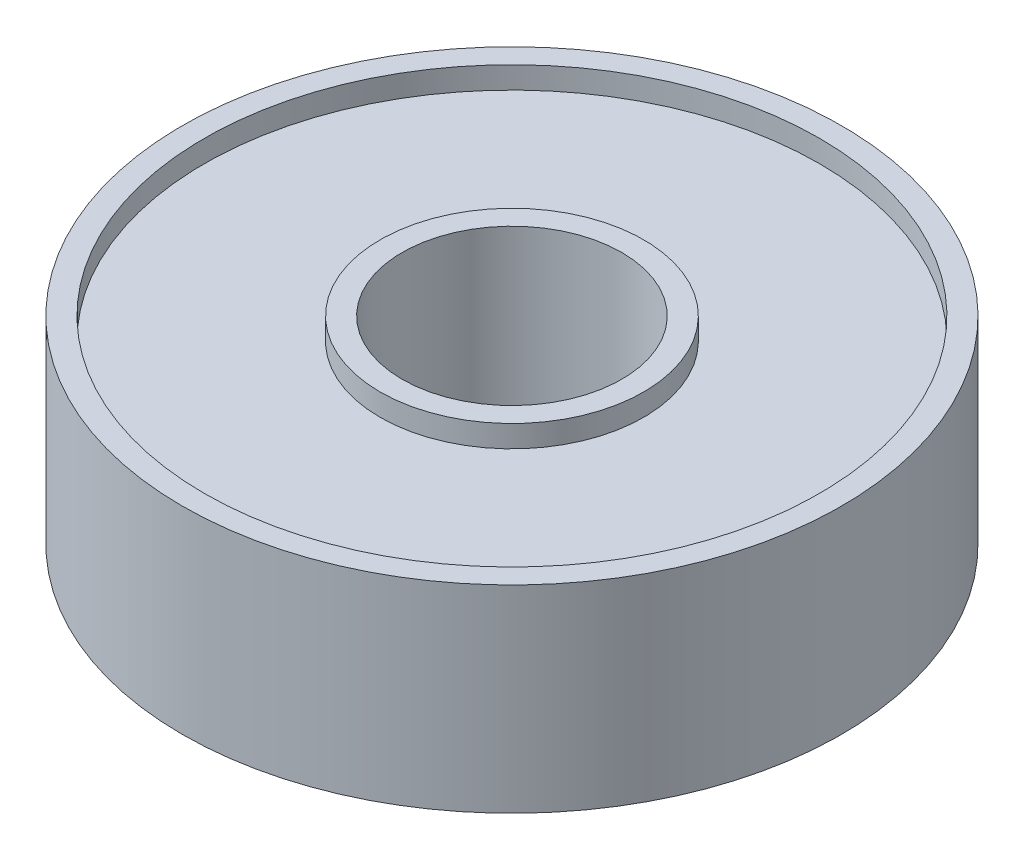
from build123d import *

# Parameters (mm, degrees)
SKETCH1_R            = 15
MAIN_EXTRUSION_DEPTH = 9
SKETCH2_R            = 5
ID_BORE_DEPTH        = 20
SKETCH3_R            = 14
SKETCH3_R_2          = 6
FACE_RECESS_DEPTH    = 1
CUT_EXTRUDE1_START   = -1
SKETCH4_R            = 14
SKETCH4_R_2          = 6
CUT_EXTRUDE1_DEPTH   = 1


with BuildPart() as part:
    # Sketch1 → main extrusion (new body)
    with BuildSketch(Plane(origin=(0, 0, 0), x_dir=(1, 0, 0), z_dir=(0, 1, 0))):
        with Locations(Location((0, 0, 0), (0, 0, 270))):
            Circle(SKETCH1_R)
    extrude(amount=MAIN_EXTRUSION_DEPTH)

    # Sketch2 → ID bore (cut)
    with BuildSketch(Plane(origin=(0, 9, 0), x_dir=(1, 0, 0), z_dir=(0, 1, 0))):
        with Locations(Location((0, 0, 0), (0, 0, 270))):
            Circle(SKETCH2_R)
    extrude(amount=-ID_BORE_DEPTH, mode=Mode.SUBTRACT)

    # Sketch3 → face recess (cut)
    with BuildSketch(Plane(origin=(0, 9, 0), x_dir=(1, 0, 0), z_dir=(0, 1, 0))):
        with Locations(Location((0, 0, 0), (0, 0, 270))):
            Circle(SKETCH3_R)
        with Locations(Location((0, 0, 0), (0, 0, 270))):
            Circle(SKETCH3_R_2, mode=Mode.SUBTRACT)
    extrude(amount=-FACE_RECESS_DEPTH, mode=Mode.SUBTRACT)

    # Sketch4 → Cut-Extrude1 (cut)
    with BuildSketch(Plane.XZ.offset(CUT_EXTRUDE1_START)):
        with Locations(Location((0, 0, 0), (0, 0, 90))):
            Circle(SKETCH4_R)
        with Locations(Location((0, 0, 0), (0, 0, 90))):
            Circle(SKETCH4_R_2, mode=Mode.SUBTRACT)
    extrude(amount=CUT_EXTRUDE1_DEPTH, mode=Mode.SUBTRACT)


solid = part.part
